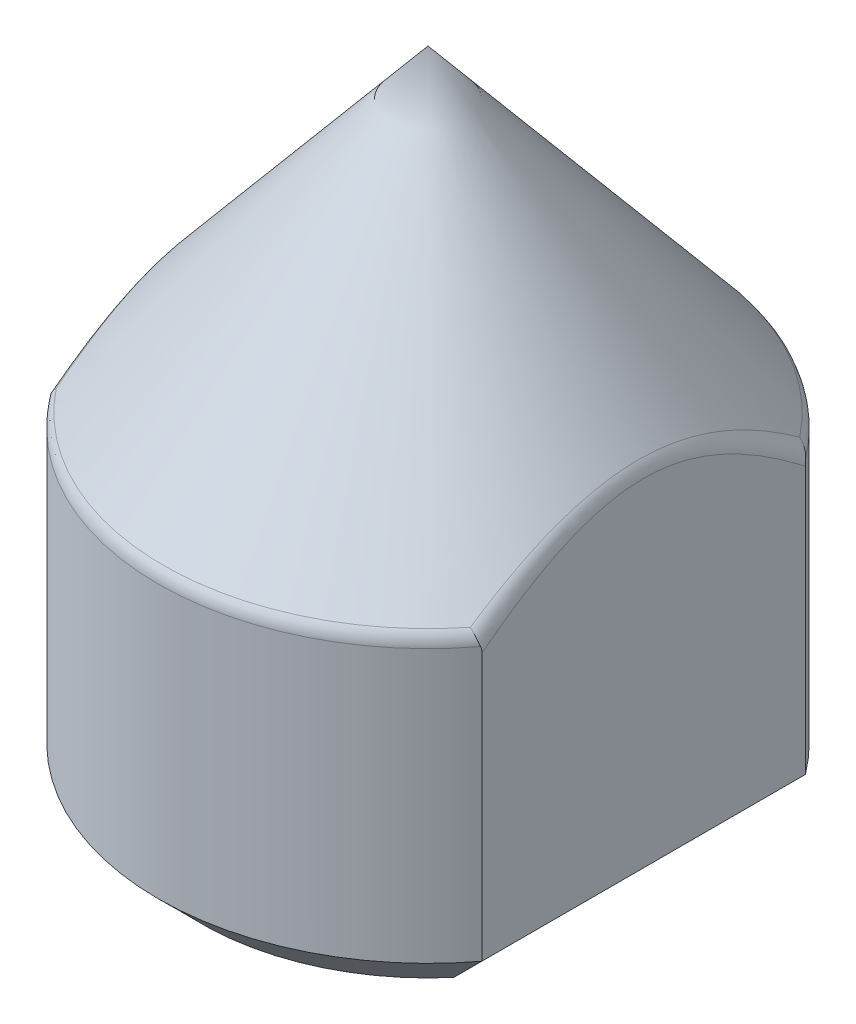
from build123d import *

# Parameters (mm, degrees)
SKETCH1_R           = 12.5
BOSS_EXTRUDE2_DEPTH = 15
CUT_EXTRUDE1_REACH  = 36.821
CHAMFER1_SIZE       = 2
FILLET1_R           = 1


with BuildPart() as part:
    # Sketch1 → Boss-Extrude2 (new body)
    with BuildSketch(Plane(origin=(0, 0, 0), x_dir=(1, 0, 0), z_dir=(0, 1, 0))):
        with Locations(Location((0, 0, 0), (0, 0, 270))):
            Circle(SKETCH1_R)
    extrude(amount=BOSS_EXTRUDE2_DEPTH)

    # Sketch2 → Revolve1 (revolve)
    with BuildSketch(Plane.XY):
        Polygon((12.5, 15), (0, 30), (0, 15), align=None)
    revolve(axis=Axis((0, -1000, 0), (0, 1, 0)))

    # Cut-Extrude1: up to this cone (the profile starts inside it)
    cut_extrude1_end = Plane(origin=(0, 0, 0), z_dir=(0, -1, 0)).offset(-29.999999) * Cone(1e-06, 76.934166667, 92.320999, align=(Align.CENTER, Align.CENTER, Align.MIN), mode=Mode.PRIVATE)
    # Sketch3 → Cut-Extrude1 (cut, up to the surface)
    with BuildSketch(Plane(origin=(0, 0, 0), x_dir=(1, 0, 0), z_dir=(0, 1, 0)), mode=Mode.PRIVATE) as cut_extrude1_sk1:
        with BuildLine():
            Line((-10, 7.5), (-10, -7.5))
            ThreePointArc((-10, -7.5), (-12.5, 0), (-10, 7.5))
        make_face()
    cut_extrude1_tool1 = extrude(cut_extrude1_sk1.sketch, amount=CUT_EXTRUDE1_REACH, mode=Mode.PRIVATE) & cut_extrude1_end
    add(cut_extrude1_tool1.solids().sort_by_distance((-11.0091, 0, 0))[0], mode=Mode.SUBTRACT)
    # Sketch3 → Cut-Extrude1 (cut, up to the surface)
    with BuildSketch(Plane(origin=(0, 0, 0), x_dir=(1, 0, 0), z_dir=(0, 1, 0)), mode=Mode.PRIVATE) as cut_extrude1_sk2:
        with BuildLine():
            Line((10, 7.5), (10, -7.5))
            ThreePointArc((10, -7.5), (12.5, 0), (10, 7.5))
        make_face()
    cut_extrude1_tool2 = extrude(cut_extrude1_sk2.sketch, amount=CUT_EXTRUDE1_REACH, mode=Mode.PRIVATE) & cut_extrude1_end
    add(cut_extrude1_tool2.solids().sort_by_distance((11.0091, 0, 0))[0], mode=Mode.SUBTRACT)

    # Chamfer1
    chamfer1_edges = [part.edges().sort_by_distance(p)[0] for p in [
        (0, 0, -12.5),
        (0, 0, 12.5),
        (-10, 0, 0),
        (10, 0, 0),
    ]]
    chamfer(chamfer1_edges, length=CHAMFER1_SIZE)

    # Fillet1
    fillet1_edges = [part.edges().sort_by_distance(p)[0] for p in [
        (-10, 17.087815774, 3.972518962),
        (10, 17.087815774, -3.972518962),
        (0, 15, -12.5),
        (0, 15, 12.5),
    ]]
    fillet(fillet1_edges, radius=FILLET1_R)


solid = part.part
